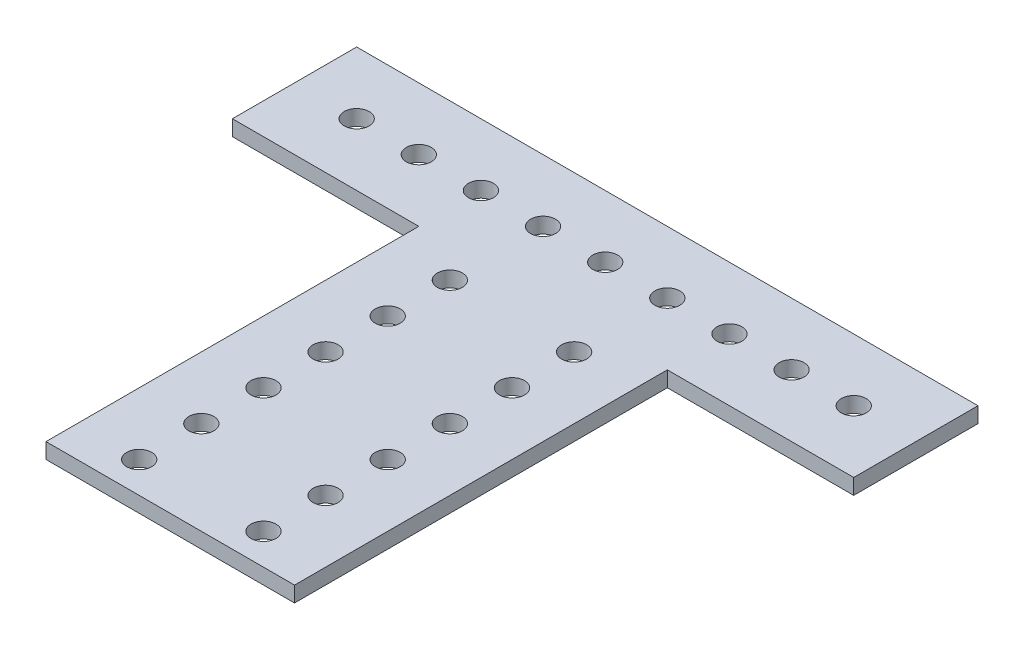
from build123d import *

# Parameters (mm, degrees)
BOSS_EXTRUDE1_DEPTH = 3.175
SKETCH2_R           = 2.5527
CUT_EXTRUDE1_DEPTH  = 136.04018152
SKETCH3_R           = 2.5527
CUT_EXTRUDE2_DEPTH  = 136.04018152


with BuildPart() as part:
    # Sketch1 → Boss-Extrude1 (new body)
    with BuildSketch(Plane(origin=(0, 0, 0), x_dir=(1, 0, 0), z_dir=(0, 1, 0))):
        Polygon((0, 0), (50.8, 0), (50.8, 76.2), (88.9, 76.2), (88.9, 101.6), (-38.1, 101.6), (-38.1, 76.2), (0, 76.2), align=None)
    extrude(amount=BOSS_EXTRUDE1_DEPTH)

    # Sketch2 → Cut-Extrude1 (cut, through all)
    with BuildSketch(Plane(origin=(0, 3.175, 0), x_dir=(1, 0, 0), z_dir=(0, 1, 0))):
        with Locations(Location((38.1, 6.35, 0), (0, 0, 270))):
            Circle(SKETCH2_R)
        with Locations(Location((12.7, 6.35, 0), (0, 0, 270))):
            Circle(SKETCH2_R)
        with Locations(Location((38.1, 19.05, 0), (0, 0, 270))):
            Circle(SKETCH2_R)
        with Locations(Location((12.7, 19.05, 0), (0, 0, 270))):
            Circle(SKETCH2_R)
        with Locations(Location((38.1, 31.75, 0), (0, 0, 270))):
            Circle(SKETCH2_R)
        with Locations(Location((12.7, 31.75, 0), (0, 0, 270))):
            Circle(SKETCH2_R)
        with Locations(Location((38.1, 44.45, 0), (0, 0, 270))):
            Circle(SKETCH2_R)
        with Locations(Location((12.7, 44.45, 0), (0, 0, 270))):
            Circle(SKETCH2_R)
        with Locations(Location((38.1, 57.15, 0), (0, 0, 270))):
            Circle(SKETCH2_R)
        with Locations(Location((12.7, 57.15, 0), (0, 0, 270))):
            Circle(SKETCH2_R)
        with Locations(Location((38.1, 69.85, 0), (0, 0, 270))):
            Circle(SKETCH2_R)
        with Locations(Location((12.7, 69.85, 0), (0, 0, 270))):
            Circle(SKETCH2_R)
    extrude(amount=-CUT_EXTRUDE1_DEPTH, mode=Mode.SUBTRACT)

    # Sketch3 → Cut-Extrude2 (cut, through all)
    with BuildSketch(Plane(origin=(0, 3.175, 0), x_dir=(1, 0, 0), z_dir=(0, 1, 0))):
        with Locations(Location((76.2, 88.9, 0), (0, 0, 270))):
            Circle(SKETCH3_R)
        with Locations(Location((63.5, 88.9, 0), (0, 0, 270))):
            Circle(SKETCH3_R)
        with Locations(Location((50.8, 88.9, 0), (0, 0, 270))):
            Circle(SKETCH3_R)
        with Locations(Location((38.1, 88.9, 0), (0, 0, 270))):
            Circle(SKETCH3_R)
        with Locations(Location((25.4, 88.9, 0), (0, 0, 270))):
            Circle(SKETCH3_R)
        with Locations(Location((12.7, 88.9, 0), (0, 0, 270))):
            Circle(SKETCH3_R)
        with Locations(Location((0, 88.9, 0), (0, 0, 270))):
            Circle(SKETCH3_R)
        with Locations(Location((-12.7, 88.9, 0), (0, 0, 270))):
            Circle(SKETCH3_R)
        with Locations(Location((-25.4, 88.9, 0), (0, 0, 270))):
            Circle(SKETCH3_R)
    extrude(amount=-CUT_EXTRUDE2_DEPTH, mode=Mode.SUBTRACT)


solid = part.part
